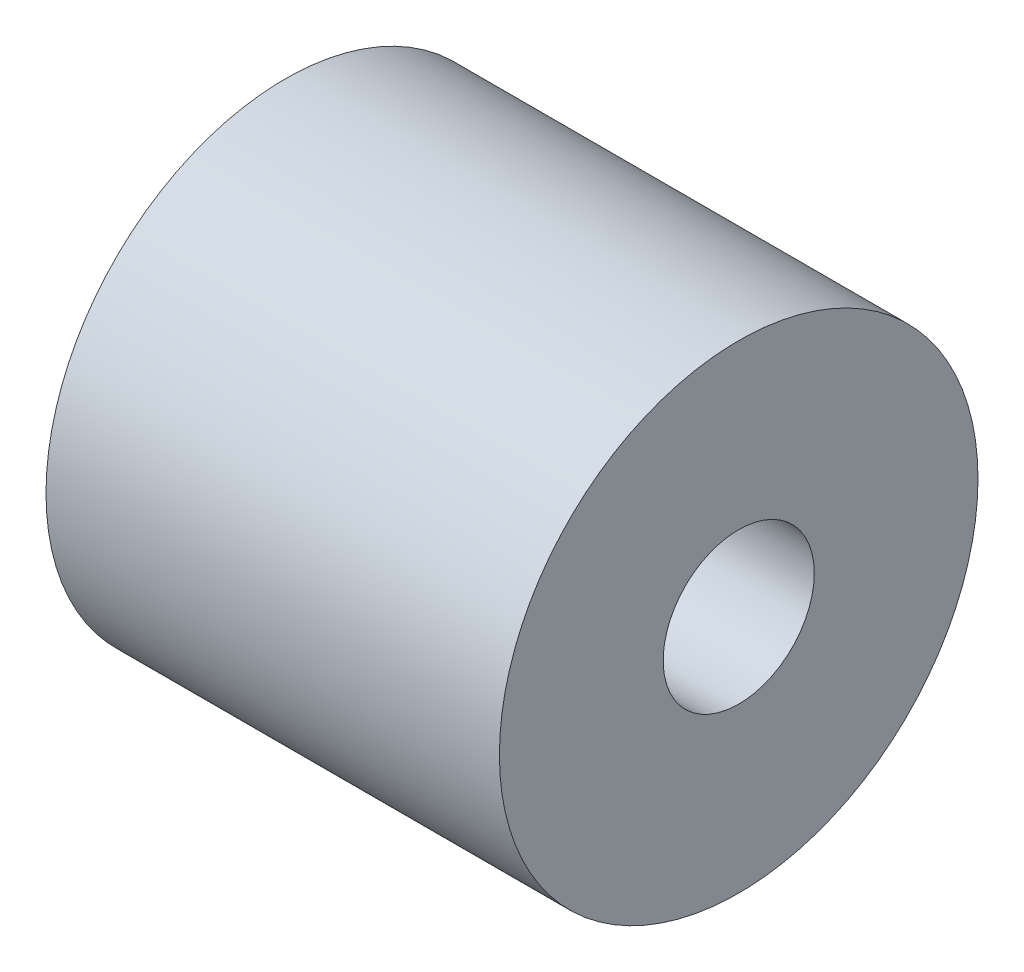
from build123d import *

# Parameters (mm, degrees)
BOSS_EXTRUDE1_DEPTH      = 9
BOSS_EXTRUDE1_DEPTH_BACK = 9
SKETCH1_R                = 9.5
SKETCH1_R_2              = 3


with BuildPart() as part:
    # Sketch1 → Boss-Extrude1 (new, two sides: drawn at the far end of the back side and taken through both)
    with BuildSketch(Plane(origin=(0, 0, 0), x_dir=(0, 0, -1), z_dir=(1, 0, 0)).offset(-BOSS_EXTRUDE1_DEPTH_BACK)):
        Circle(SKETCH1_R)
        Circle(SKETCH1_R_2, mode=Mode.SUBTRACT)
    extrude(amount=BOSS_EXTRUDE1_DEPTH + BOSS_EXTRUDE1_DEPTH_BACK)


solid = part.part
